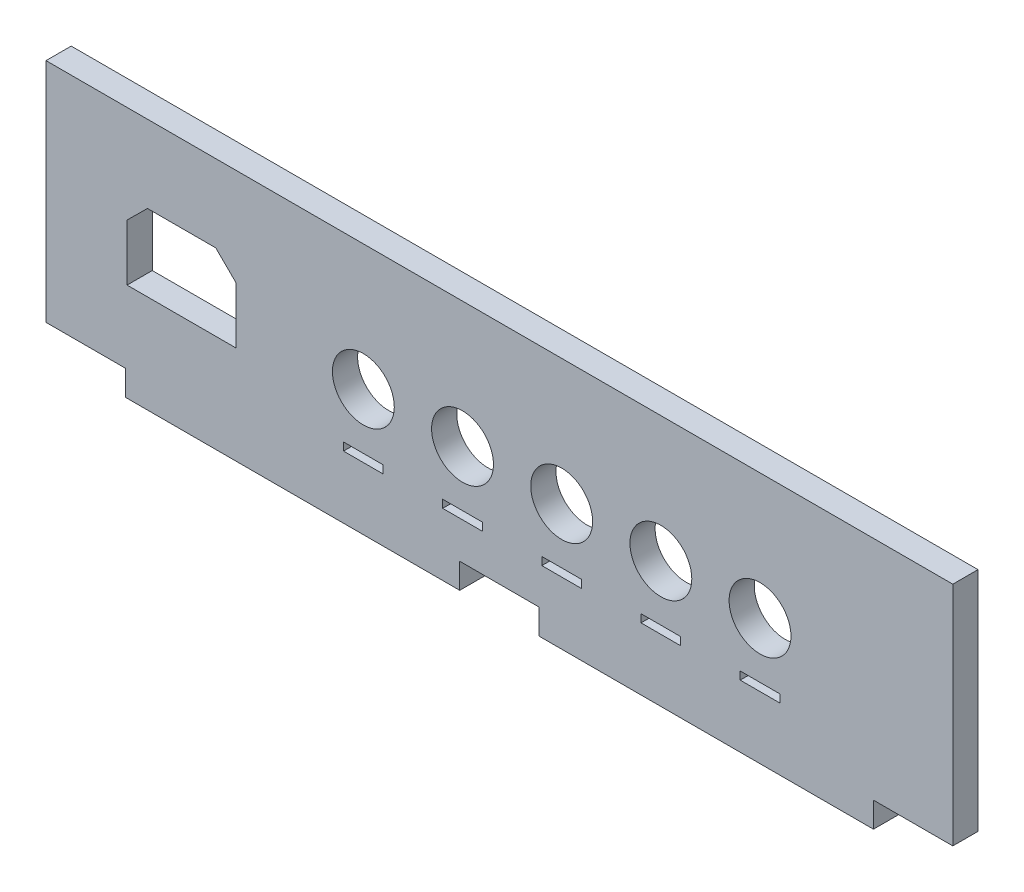
from build123d import *

# Parameters (mm, degrees)
SKETCH1_W           = 228.6
SKETCH1_H           = 63.5
BOSS_EXTRUDE1_DEPTH = 6.35
SKETCH3_R           = 7.8
SKETCH3_W           = 20
SKETCH3_H           = 6.35
SKETCH3_W_2         = 10
SKETCH3_H_2         = 2
CUT_EXTRUDE1_DEPTH  = 119.79762203
CUT_EXTRUDE2_DEPTH  = 119.79762203


with BuildPart() as part:
    # Sketch1 → Boss-Extrude1 (new body)
    with BuildSketch(Plane.XY):
        Rectangle(SKETCH1_W, SKETCH1_H)
    extrude(amount=BOSS_EXTRUDE1_DEPTH)

    # Sketch3 → Cut-Extrude1 (cut, through all)
    with BuildSketch(Plane.XY.offset(6.35)):
        with Locations((-34.3, 0)):
            Circle(SKETCH3_R)
        with Locations((-9.3, 0)):
            Circle(SKETCH3_R)
        with Locations((15.7, 0)):
            Circle(SKETCH3_R)
        with Locations((40.7, 0)):
            Circle(SKETCH3_R)
        with Locations((65.7, 0)):
            Circle(SKETCH3_R)
        with Locations((-104.3, -28.575)):
            Rectangle(SKETCH3_W, SKETCH3_H)
        with Locations((0, -28.575)):
            Rectangle(SKETCH3_W, SKETCH3_H)
        with Locations((104.3, -28.575)):
            Rectangle(SKETCH3_W, SKETCH3_H)
        with Locations((-9.3, -15)):
            Rectangle(SKETCH3_W_2, SKETCH3_H_2)
        with Locations((-34.3, -15)):
            Rectangle(SKETCH3_W_2, SKETCH3_H_2)
        with Locations((15.7, -15)):
            Rectangle(SKETCH3_W_2, SKETCH3_H_2)
        with Locations((40.7, -15)):
            Rectangle(SKETCH3_W_2, SKETCH3_H_2)
        with Locations((65.7, -15)):
            Rectangle(SKETCH3_W_2, SKETCH3_H_2)
    extrude(amount=-CUT_EXTRUDE1_DEPTH, mode=Mode.SUBTRACT)

    # Sketch5 → Cut-Extrude2 (cut, through all)
    with BuildSketch(Plane(origin=(0, 0, 0), x_dir=(-1, 0, 0), z_dir=(0, 0, -1))):
        Polygon((93.861415546, -7.039545532), (66.361415546, -7.039545532), (66.361415546, 7.169080451), (71.505824709, 12.260454468), (88.717006383, 12.260454468), (93.861415546, 7.169080451), align=None)
    extrude(amount=-CUT_EXTRUDE2_DEPTH, mode=Mode.SUBTRACT)


solid = part.part
